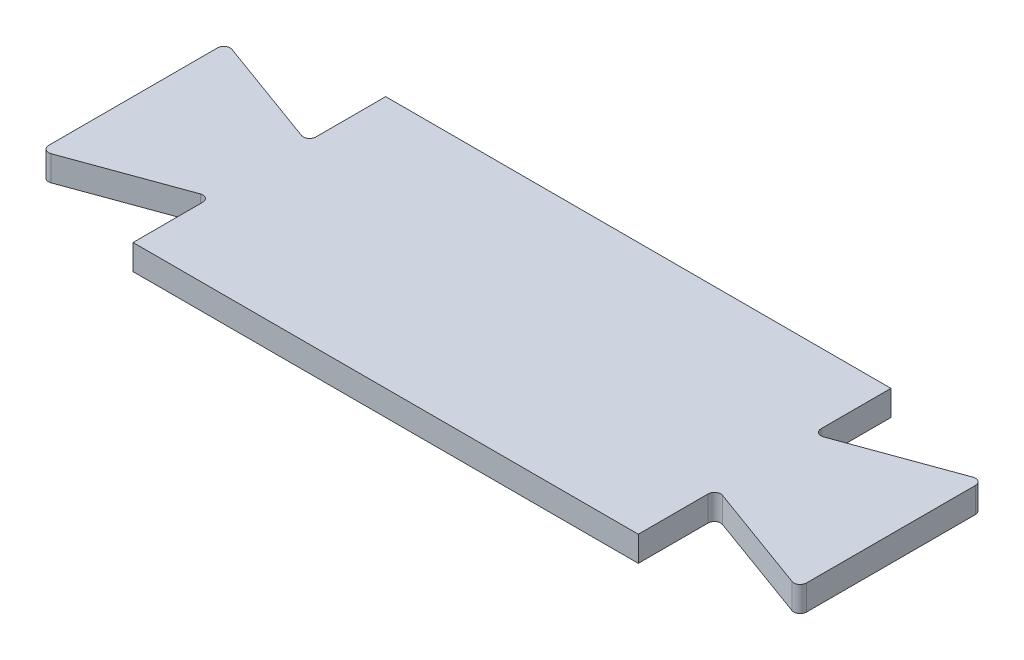
from build123d import *

# Parameters (mm, degrees)
BOSS_EXTRUDE1_DEPTH = 1
FILLET1_R           = 0.25


with BuildPart() as part:
    # Sketch1 → Boss-Extrude1 (new body)
    with BuildSketch(Plane(origin=(0, 0, 0), x_dir=(1, 0, 0), z_dir=(0, 1, 0))):
        Polygon((-10, 1.880148829), (-15, 3.7), (-15, -3.7), (-10, -1.880148829), (-10, -5), (10, -5), (10, -1.880148829), (15, -3.7), (15, 3.7), (10, 1.880148829), (10, 5), (-10, 5), align=None)
    extrude(amount=BOSS_EXTRUDE1_DEPTH)

    # Fillet1
    fillet1_edges = [part.edges().sort_by_distance(p)[0] for p in [
        (10, 0.5, -1.880148829),
        (15, 0.5, -3.7),
        (15, 0.5, 3.7),
        (10, 0.5, 1.880148829),
        (-10, 0.5, 1.880148829),
        (-15, 0.5, 3.7),
        (-15, 0.5, -3.7),
        (-10, 0.5, -1.880148829),
    ]]
    fillet(fillet1_edges, radius=FILLET1_R)


solid = part.part
